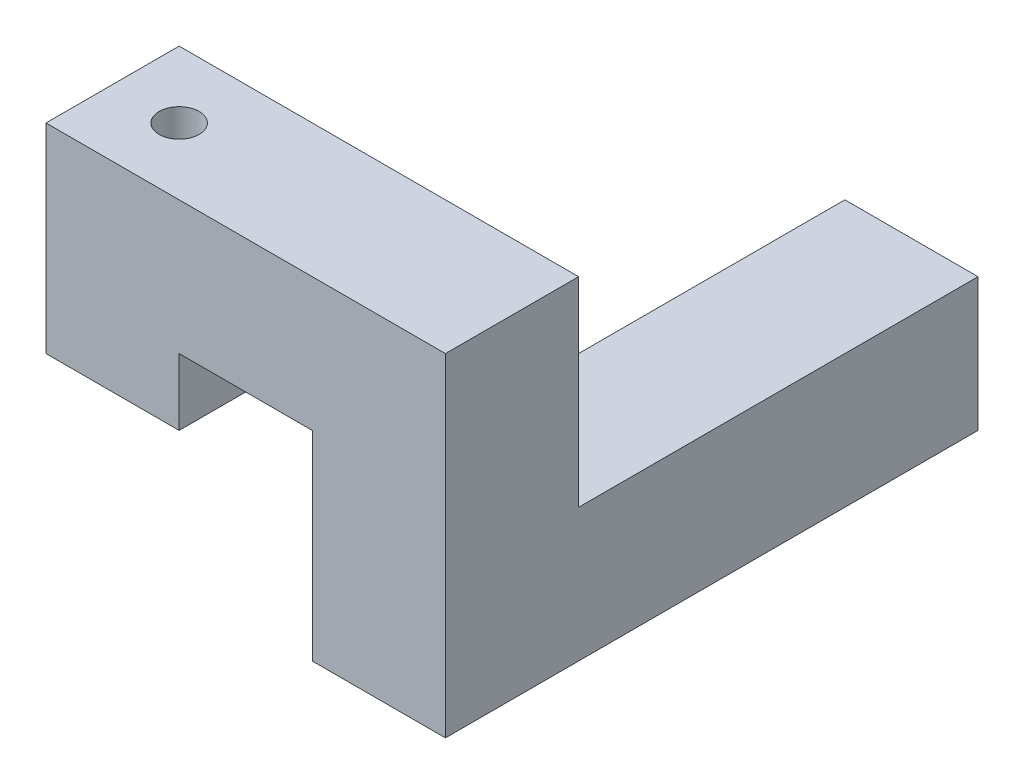
from build123d import *

# Parameters (mm, degrees)
SKETCH_1_W          = 20
SKETCH_1_H          = 20
EXTRUDE_1_DEPTH     = 30
SKETCH_2_W          = 20
SKETCH_2_H          = 20
EXTRUDE_2_DEPTH     = 40
SKETCH_6_W          = 20
SKETCH_6_H          = 20
EXTRUDE_3_DEPTH     = 30
SKETCH_7_W          = 20
SKETCH_7_H          = 20
EXTRUDE_4_DEPTH     = 60
SKETCH_8_R          = 3
CUT_EXTRUDE_1_DEPTH = 60


with BuildPart() as part:
    # 草图1 → 凸台-拉伸1 (new body)
    with BuildSketch(Plane(origin=(0, 0, 0), x_dir=(1, 0, 0), z_dir=(0, 1, 0))):
        Rectangle(SKETCH_1_W, SKETCH_1_H)
    extrude(amount=EXTRUDE_1_DEPTH)

    # 草图2 → 凸台-拉伸2 (add)
    with BuildSketch(Plane(origin=(10, 0, 0), x_dir=(0, 0, -1), z_dir=(1, 0, 0))):
        with Locations((0, 20)):
            Rectangle(SKETCH_2_W, SKETCH_2_H)
    extrude(amount=EXTRUDE_2_DEPTH)

    # 草图6 → 凸台-拉伸3 (add)
    with BuildSketch(Plane.XZ.offset(-10)):
        with Locations((40, 0)):
            Rectangle(SKETCH_6_W, SKETCH_6_H)
    extrude(amount=EXTRUDE_3_DEPTH)

    # 草图7 → 凸台-拉伸4 (add)
    with BuildSketch(Plane(origin=(0, 0, -10), x_dir=(-1, 0, 0), z_dir=(0, 0, -1))):
        with Locations((-40, -10)):
            Rectangle(SKETCH_7_W, SKETCH_7_H)
    extrude(amount=EXTRUDE_4_DEPTH)

    # 草图8 → 切除-拉伸1 (cut)
    with BuildSketch(Plane(origin=(0, 0, 0), x_dir=(-1, 0, 0), z_dir=(0, -1, 0))):
        with Locations(Location((0, 0, 0), (0, 0, 90))):
            Circle(SKETCH_8_R)
    extrude(amount=-CUT_EXTRUDE_1_DEPTH, mode=Mode.SUBTRACT)


solid = part.part
